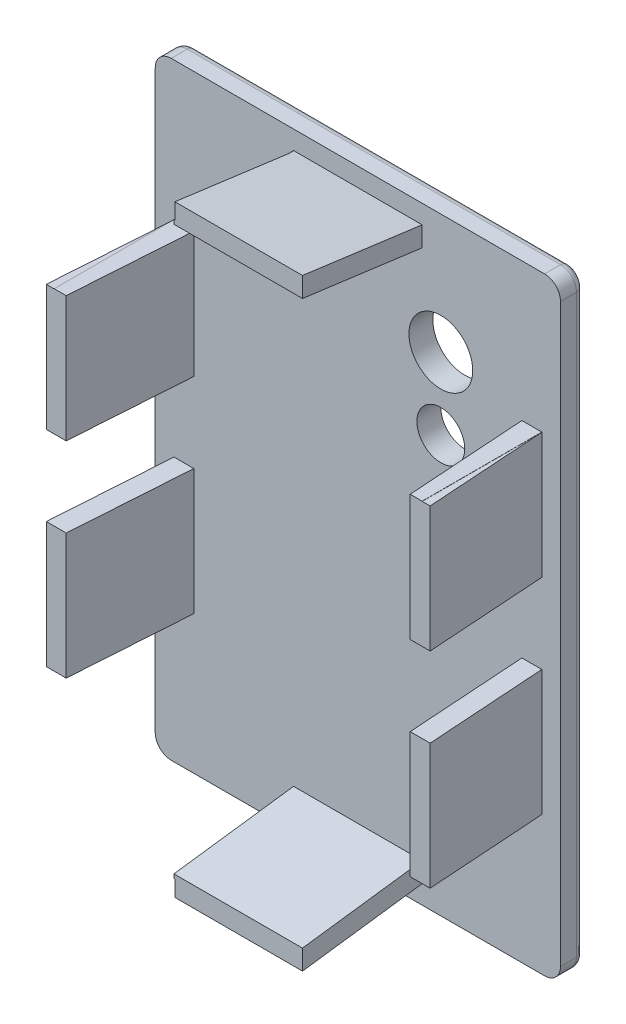
from build123d import *

# Parameters (mm, degrees)
CROQUIS1_W              = 50.8
CROQUIS1_H              = 76.2
SALIENTE_EXTRUIR1_DEPTH = 18
CROQUIS2_W              = 50.8
CROQUIS2_H              = 76.2
CROQUIS2_W_2            = 46.12
CROQUIS2_H_2            = 71.52
CROQUIS2_W_3            = 38.8
CROQUIS2_H_3            = 64.2
CORTAR_EXTRUIR1_DEPTH   = 15
CORTAR_EXTRUIR8_DEPTH   = 15
SALIENTE_EXTRUIR3_DEPTH = 41.5
CORTAR_EXTRUIR9_DEPTH   = 51.5
CORTAR_EXTRUIR10_DEPTH  = 51.5
SALIENTE_EXTRUIR4_DEPTH = 16
CORTAR_EXTRUIR11_DEPTH  = 16.5
REDONDEO3_R             = 2
REDONDEO4_R             = 1
CROQUIS15_W             = 48.12
CROQUIS15_H             = 10
CORTAR_EXTRUIR12_DEPTH  = 15
CROQUIS16_W             = 8
CROQUIS16_H             = 1.5
CORTAR_EXTRUIR13_DEPTH  = 2
CROQUIS17_R             = 4
CROQUIS17_R_2           = 3
CORTAR_EXTRUIR14_DEPTH  = 10


with BuildPart() as part:
    # Croquis1 → Saliente-Extruir1 (new body)
    with BuildSketch(Plane.XY):
        Rectangle(CROQUIS1_W, CROQUIS1_H)
    extrude(amount=SALIENTE_EXTRUIR1_DEPTH)

    # Croquis2 → Cortar-Extruir1 (cut)
    # profile 1 of 2: a face of its own
    with BuildSketch(Plane.XY.offset(18)):
        Rectangle(CROQUIS2_W, CROQUIS2_H)
        Rectangle(CROQUIS2_W_2, CROQUIS2_H_2, mode=Mode.SUBTRACT)
    # profile 2 of 2: a face of its own
    with BuildSketch(Plane.XY.offset(18)):
        Rectangle(CROQUIS2_W_3, CROQUIS2_H_3)
    extrude(amount=-CORTAR_EXTRUIR1_DEPTH, mode=Mode.SUBTRACT)

    # Croquis6 → Cortar-Extruir8 (cut)
    with BuildSketch(Plane.XY.offset(18)):
        Polygon((-23.06, 35.76), (-8.06, 35.76), (-8.06, 32.1), (-19.4, 32.1), (-19.4, 20.76), (-23.06, 20.76), align=None)
        Polygon((23.06, 35.76), (8.06, 35.76), (8.06, 32.1), (19.4, 32.1), (19.4, 20.76), (23.06, 20.76), align=None)
        Polygon((-23.06, -35.76), (-23.06, -20.76), (-19.4, -20.76), (-19.4, -32.1), (-8.06, -32.1), (-8.06, -35.76), align=None)
        Polygon((23.06, -35.76), (8.06, -35.76), (8.06, -32.1), (19.4, -32.1), (19.4, -20.76), (23.06, -20.76), align=None)
    extrude(amount=-CORTAR_EXTRUIR8_DEPTH, mode=Mode.SUBTRACT)

    # Croquis10 → Saliente-Extruir3 (add)
    with BuildSketch(Plane(origin=(0, -20.76, 0), x_dir=(-1, 0, 0), z_dir=(0, -1, 0))):
        Polygon((23.06, -18), (24.06, -18), (23.06, -3), align=None)
        Polygon((-23.06, -18), (-24.06, -18), (-23.06, -3), align=None)
    extrude(amount=-SALIENTE_EXTRUIR3_DEPTH)

    # Croquis11 → Cortar-Extruir9 (cut)
    with BuildSketch(Plane.XZ.offset(20.76)):
        Polygon((-19.4, 18), (-21.56, 18), (-20.56, 3), (-19.4, 3), align=None)
    extrude(amount=-CORTAR_EXTRUIR9_DEPTH, mode=Mode.SUBTRACT)

    # Croquis12 → Cortar-Extruir10 (cut)
    with BuildSketch(Plane.XZ.offset(20.76)):
        Polygon((19.4, 18), (19.4, 3), (20.56, 3), (21.56, 18), align=None)
    extrude(amount=-CORTAR_EXTRUIR10_DEPTH, mode=Mode.SUBTRACT)

    # Croquis13 → Saliente-Extruir4 (add)
    with BuildSketch(Plane(origin=(8.06, 0, 0), x_dir=(0, 0, -1), z_dir=(1, 0, 0))):
        Polygon((-18, -35.76), (-18, -37.76), (-3, -35.76), align=None)
        Polygon((-18, 35.76), (-18, 37.76), (-3, 35.76), align=None)
    extrude(amount=-SALIENTE_EXTRUIR4_DEPTH)

    # Croquis14 → Cortar-Extruir11 (cut)
    with BuildSketch(Plane(origin=(8.06, 0, 0), x_dir=(0, 0, -1), z_dir=(1, 0, 0))):
        Polygon((-3, -32.1), (-18, -32.1), (-18, -35.26), (-3, -33.26), align=None)
        Polygon((-18, 32.1), (-18, 35.26), (-3, 33.26), (-3, 32.1), align=None)
    extrude(amount=-CORTAR_EXTRUIR11_DEPTH, mode=Mode.SUBTRACT)

    # Redondeo3
    redondeo3_edges = [part.edges().sort_by_distance(p)[0] for p in [
        (-25.4, 38.1, 1.5),
        (25.4, 38.1, 1.5),
        (25.4, -38.1, 1.5),
        (-25.4, -38.1, 1.5),
    ]]
    fillet(redondeo3_edges, radius=REDONDEO3_R)

    # Redondeo4
    redondeo4_edges = [part.edges().sort_by_distance(p)[0] for p in [
        (0, 38.1, 0),
        (-25.4, 0, 0),
        (25.4, 0, 0),
        (0, -38.1, 0),
        (24.814213562, -37.514213562, 0),
        (-24.814213562, -37.514213562, 0),
        (-24.814213562, 37.514213562, 0),
        (24.814213562, 37.514213562, 0),
    ]]
    fillet(redondeo4_edges, radius=REDONDEO4_R)

    # Croquis15 → Cortar-Extruir12 (cut)
    with BuildSketch(Plane.XY.offset(18)):
        with Locations((0, -0.01)):
            Rectangle(CROQUIS15_W, CROQUIS15_H)
    extrude(amount=-CORTAR_EXTRUIR12_DEPTH, mode=Mode.SUBTRACT)

    # Croquis16 → Cortar-Extruir13 (cut)
    with BuildSketch(Plane.XZ.offset(38.1)):
        with Locations((0, 2.25)):
            Rectangle(CROQUIS16_W, CROQUIS16_H)
    extrude(amount=-CORTAR_EXTRUIR13_DEPTH, mode=Mode.SUBTRACT)

    # Croquis17 → Cortar-Extruir14 (cut)
    with BuildSketch(Plane.XY.offset(3)):
        with Locations((10.4, 23.1)):
            Circle(CROQUIS17_R)
        with Locations((10.4, 14.1)):
            Circle(CROQUIS17_R_2)
    extrude(amount=-CORTAR_EXTRUIR14_DEPTH, mode=Mode.SUBTRACT)


solid = part.part
